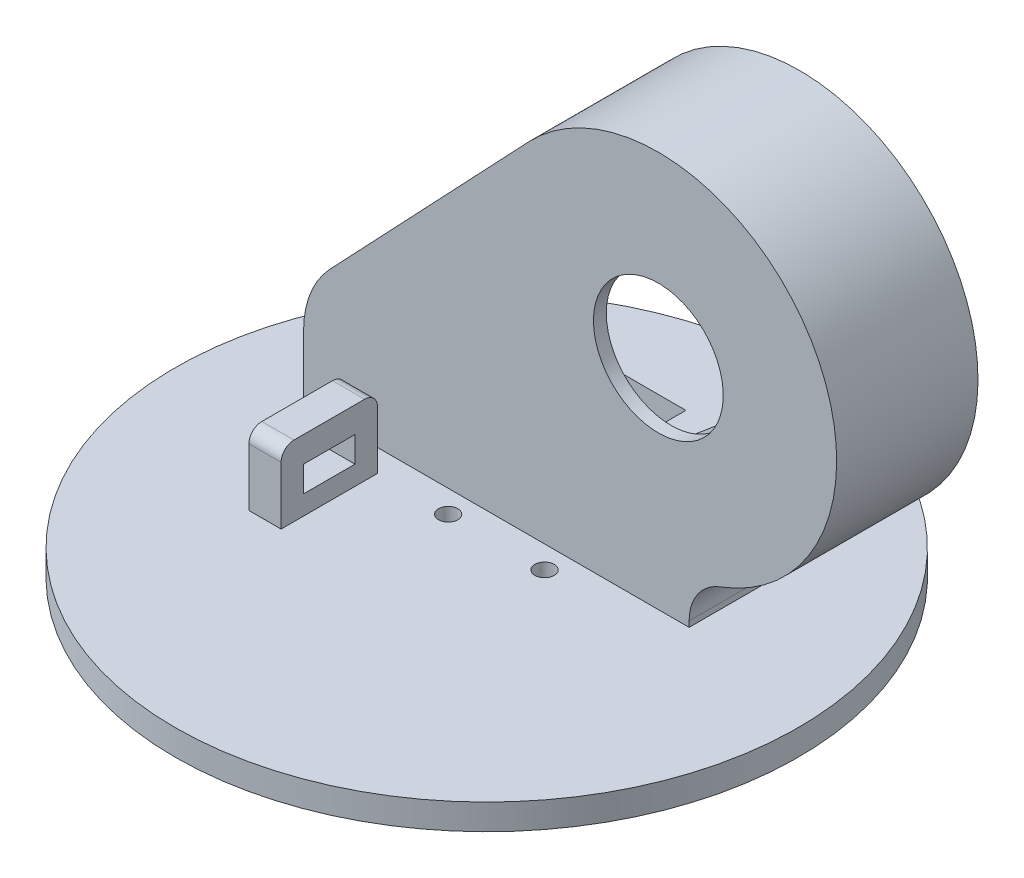
from build123d import *

# Parameters (mm, degrees)
SKETCH1_R               = 48.5
SKETCH1_R_2             = 1.5
SKETCH1_W               = 5
SKETCH1_H               = 15
BOSS_EXTRUDE1_DEPTH     = 4
SKETCH1_4_W             = 5
SKETCH1_4_H             = 15
BOSS_EXTRUDE2_DEPTH     = 15
FILLET1_R               = 2
EXTRUDE_THIN1_DEPTH     = 11
BOSS_EXTRUDE3_START     = 11
SKETCH3_4_R             = 10.1
BOSS_EXTRUDE3_DEPTH     = 11
CUT_EXTRUDE2_DEPTH      = 11
SKETCH8_R               = 1.5
CUT_EXTRUDE3_DEPTH      = 9
CUT_EXTRUDE4_DEPTH      = 110.483799158
CUT_EXTRUDE4_DEPTH_BACK = 110.483799158
SKETCH9_W               = 8
SKETCH9_H               = 4
SKETCH10_W              = 15
SKETCH10_H              = 10
CUT_EXTRUDE5_DEPTH      = 93.739106768
FILLET2_R               = 7.5
BOSS_EXTRUDE4_START     = 2.5
SKETCH11_R              = 1.5
BOSS_EXTRUDE4_DEPTH     = 2.5


with BuildPart() as part:
    # Sketch1 → Boss-Extrude1 (new body)
    with BuildSketch(Plane(origin=(0, 0, 0), x_dir=(1, 0, 0), z_dir=(0, 1, 0))):
        with Locations(Location((0, 0, 0), (0, 0, 270))):
            Circle(SKETCH1_R)
        with Locations(Location((7.5, 1.5, 0), (0, 0, 270))):
            Circle(SKETCH1_R_2, mode=Mode.SUBTRACT)
        with Locations(Location((-7.5, 1.5, 0), (0, 0, 270))):
            Circle(SKETCH1_R_2, mode=Mode.SUBTRACT)
        with Locations((-21, -6)):
            Rectangle(SKETCH1_W, SKETCH1_H, mode=Mode.SUBTRACT)
    extrude(amount=BOSS_EXTRUDE1_DEPTH)

    # Sketch1<4> → Boss-Extrude2 (add)
    with BuildSketch(Plane(origin=(0, 0, 0), x_dir=(1, 0, 0), z_dir=(0, 1, 0))):
        with Locations((-21, -6)):
            Rectangle(SKETCH1_4_W, SKETCH1_4_H)
    extrude(amount=BOSS_EXTRUDE2_DEPTH)

    # Fillet1
    fillet1_edges = [part.edges().sort_by_distance(p)[0] for p in [
        (-21, 15, -1.5),
        (-21, 15, 13.5),
    ]]
    fillet(fillet1_edges, radius=FILLET1_R)

    # Sketch3 → Extrude-Thin1 (add, symmetric)
    with BuildSketch(Plane.XY.offset(-16)):
        with BuildLine():
            Line((-33.5, 0), (-33.5, 14.02081119))
            ThreePointArc((-33.5, 14.02081119), (-32.433806578, 19.575001882), (-29.386795435, 24.339613696))
            Line((-29.386795435, 24.339613696), (1.569612084, 57))
            ThreePointArc((1.569612084, 57), (45.23729846, 52.625424101), (30.061304851, 11.446631432))
            ThreePointArc((30.061304851, 11.446631432), (28.251643763, 10.794728993), (26.5, 10))
            Line((26.5, 10), (26.5, 0))
            Line((26.5, 0), (16.5, 0))
            Line((16.5, 0), (16.5, 15.467006733))
            ThreePointArc((16.5, 15.467006733), (21.532603297, 18.690532933), (27.051891801, 20.983058074))
            ThreePointArc((27.051891801, 20.983058074), (36.759058885, 47.322646177), (8.827475707, 50.120798329))
            Line((8.827475707, 50.120798329), (-22.128931812, 17.460412025))
            ThreePointArc((-22.128931812, 17.460412025), (-23.144602193, 15.872208087), (-23.5, 14.02081119))
            Line((-23.5, 14.02081119), (-23.5, 0))
            Line((-23.5, 0), (-33.5, 0))
        make_face()
    extrude(amount=EXTRUDE_THIN1_DEPTH, both=True)

    # Sketch3<4> → Boss-Extrude3 (add)
    with BuildSketch(Plane.XY.offset(-16).offset(BOSS_EXTRUDE3_START)):
        with BuildLine():
            Line((-33.5, 0), (-33.5, 14.02081119))
            ThreePointArc((-33.5, 14.02081119), (-32.433806578, 19.575001882), (-29.386795435, 24.339613696))
            Line((-29.386795435, 24.339613696), (1.569612084, 57))
            ThreePointArc((1.569612084, 57), (45.23729846, 52.625424101), (30.061304851, 11.446631432))
            ThreePointArc((30.061304851, 11.446631432), (28.251643763, 10.794728993), (26.5, 10))
            Line((26.5, 10), (26.5, 0))
            Line((26.5, 0), (-33.5, 0))
        make_face()
        with Locations(Location((21.710183638, 37.910215363, 0), (0, 0, 180))):
            Circle(SKETCH3_4_R, mode=Mode.SUBTRACT)
    extrude(amount=-BOSS_EXTRUDE3_DEPTH)

    # Sketch5 → Cut-Extrude2 (cut)
    with BuildSketch(Plane(origin=(0, 0, -27), x_dir=(-1, 0, 0), z_dir=(0, 0, -1))):
        with BuildLine():
            Line((-16.5, 4), (25.5, 4))
            ThreePointArc((25.5, 4), (24.270182893, 20.088149503), (16.096969308, 34))
            Line((16.096969308, 34), (-3.746971171, 54.936239499))
            ThreePointArc((-3.746971171, 54.936239499), (-42.693826587, 51.034590724), (-29.158480936, 14.307559424))
            ThreePointArc((-29.158480936, 14.307559424), (-21.844187603, 10.363500889), (-16.5, 4))
        make_face()
    extrude(amount=-CUT_EXTRUDE2_DEPTH, mode=Mode.SUBTRACT)

    # Sketch8 → Cut-Extrude3 (cut)
    with BuildSketch(Plane(origin=(0, 0, -16), x_dir=(-1, 0, 0), z_dir=(0, 0, -1))):
        with Locations((-35.648743891, 43.079019683)):
            Circle(SKETCH8_R)
        with Locations((-29.220867794, 50.739464115)):
            Circle(SKETCH8_R)
        with Locations(Location((7.549265476, 19.88565885, 0), (0, 0, 180))):
            Circle(SKETCH8_R)
        with Locations(Location((1.121389379, 12.225214418, 0), (0, 0, 180))):
            Circle(SKETCH8_R)
        Polygon((-37.207336219, 36.554390196), (-23.066008806, 53.407367944), (9.107857805, 26.410288337), (-5.033469608, 9.557310589), align=None)
    extrude(amount=-CUT_EXTRUDE3_DEPTH, mode=Mode.SUBTRACT)

    # Sketch9 → Cut-Extrude4 (cut, two sides: drawn at the far end of the back side and taken through both)
    with BuildSketch(Plane.ZY.offset(23.5).offset(-CUT_EXTRUDE4_DEPTH_BACK)):
        with Locations((6, 9)):
            Rectangle(SKETCH9_W, SKETCH9_H)
    extrude(amount=CUT_EXTRUDE4_DEPTH + CUT_EXTRUDE4_DEPTH_BACK, mode=Mode.SUBTRACT)

    # Sketch10 → Cut-Extrude5 (cut, through all)
    with BuildSketch(Plane(origin=(0, 4, 0), x_dir=(1, 0, 0), z_dir=(0, 1, 0))):
        with Locations((-10.5, 29)):
            Rectangle(SKETCH10_W, SKETCH10_H)
    extrude(amount=-CUT_EXTRUDE5_DEPTH, mode=Mode.SUBTRACT)

    # Fillet2
    fillet2_edges = [part.edges().sort_by_distance(p)[0] for p in [
        (26.5, 10, -16),
    ]]
    fillet(fillet2_edges, radius=FILLET2_R)

    # Sketch11 → Boss-Extrude4 (add)
    with BuildSketch(Plane(origin=(0, 0, -16), x_dir=(-1, 0, 0), z_dir=(0, 0, -1)).offset(BOSS_EXTRUDE4_START)):
        with BuildLine():
            Line((-16.5, 4), (25.5, 4))
            ThreePointArc((25.5, 4), (24.270182893, 20.088149503), (16.096969308, 34))
            Line((16.096969308, 34), (-3.746971171, 54.936239499))
            ThreePointArc((-3.746971171, 54.936239499), (-42.693826587, 51.034590724), (-29.158480936, 14.307559424))
            ThreePointArc((-29.158480936, 14.307559424), (-21.844187603, 10.363500889), (-16.5, 4))
        make_face()
        with Locations((1.121389379, 12.225214418)):
            Circle(SKETCH11_R, mode=Mode.SUBTRACT)
        with Locations((7.549265476, 19.88565885)):
            Circle(SKETCH11_R, mode=Mode.SUBTRACT)
        with Locations((-35.648743891, 43.079019683)):
            Circle(SKETCH11_R, mode=Mode.SUBTRACT)
        with Locations((-29.220867794, 50.739464115)):
            Circle(SKETCH11_R, mode=Mode.SUBTRACT)
        Polygon((-5.033469608, 9.557310589), (9.107857805, 26.410288337), (-23.066008806, 53.407367944), (-37.207336219, 36.554390196), align=None, mode=Mode.SUBTRACT)
    extrude(amount=-BOSS_EXTRUDE4_DEPTH)


solid = part.part
